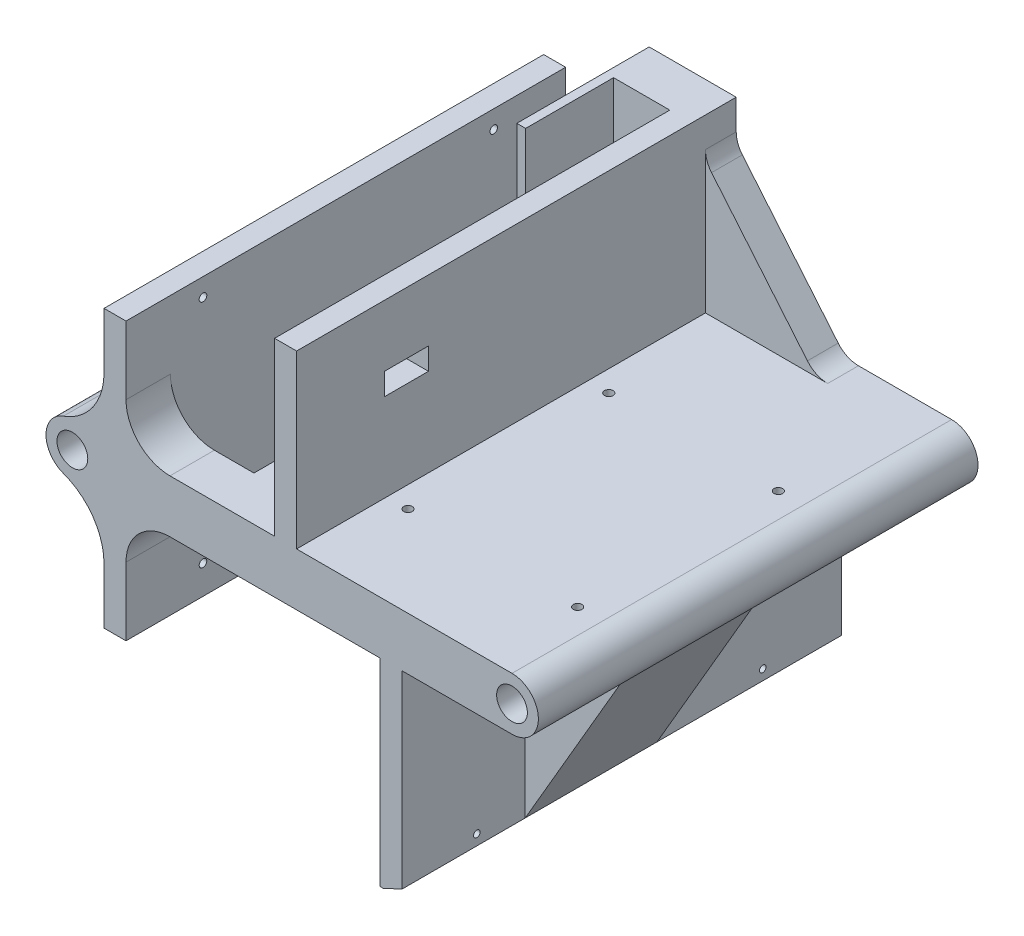
from build123d import *

# Parameters (mm, degrees)
SKETCH1_R            = 4.445
BOSS_EXTRUDE1_DEPTH  = 127
SKETCH7_W            = 6.35
SKETCH7_H            = 57.15
SKETCH7_H_2          = 80.01
SKETCH7_H_3          = 66.04
BOSS_EXTRUDE4_DEPTH  = 127
CUT_EXTRUDE2_REACH   = 191.917
SKETCH8_R            = 1.0999978
CUT_EXTRUDE4_REACH   = 200.726
SKETCH11_W           = 42.926
SKETCH11_H           = 101.345290086
FILLET1_R            = 17.78
CUT_EXTRUDE6_REACH   = 200.726
SKETCH14_R           = 1.249999967
SKETCH15_W           = 6.35
SKETCH15_H           = 127
CUT_EXTRUDE7_DEPTH   = 7.62
SKETCH16_W           = 12.827354957
SKETCH16_H           = 49.53
BOSS_EXTRUDE5_DEPTH  = 16.256
SKETCH17_W           = 38.227354957
SKETCH17_H           = 49.53
BOSS_EXTRUDE6_DEPTH  = 2.54
SKETCH18_W           = 21.632068301
SKETCH18_H           = 15.24
BOSS_EXTRUDE7_DEPTH  = 101.345290086
FILLET2_R            = 12.7
SKETCH23_R           = 0.95
CUT_EXTRUDE8_DEPTH   = 25.4
CHAMFER1_SIZE        = 2.54
CHAMFER1_SIZE2       = 5.447047578
BOSS_EXTRUDE10_DEPTH = 38.1
SKETCH26_W           = 73.406
SKETCH26_H           = 32.385
BOSS_EXTRUDE11_DEPTH = 12.827354957
FILLET3_R            = 12.7
BOSS_EXTRUDE12_DEPTH = 8.89
FILLET4_R            = 7.62
SKETCH28_W           = 6.35
SKETCH28_H           = 12.7
CUT_EXTRUDE9_DEPTH   = 25.4
SKETCH29_W           = 12.7
SKETCH29_H           = 6.35
CUT_EXTRUDE10_DEPTH  = 25.4


with BuildPart() as part:
    # Sketch1 → Boss-Extrude1 (new body)
    with BuildSketch(Plane.XY):
        with BuildLine():
            Line((0, -7.62), (127, -7.62))
            ThreePointArc((127, -7.62), (134.62, 0), (127, 7.62))
            Line((127, 7.62), (0, 7.62))
            ThreePointArc((0, 7.62), (-7.62, 0), (0, -7.62))
        make_face()
        with Locations((127, 0)):
            Circle(SKETCH1_R, mode=Mode.SUBTRACT)
        Circle(SKETCH1_R, mode=Mode.SUBTRACT)
    extrude(amount=BOSS_EXTRUDE1_DEPTH)

    # Sketch7 → Boss-Extrude4 (add)
    with BuildSketch(Plane.XY.offset(127)):
        with Locations((92.075, -36.195)):
            Rectangle(SKETCH7_W, SKETCH7_H)
        with Locations((12.319, 0)):
            Rectangle(SKETCH7_W, SKETCH7_H_2)
        with Locations((61.595, 31.75)):
            Rectangle(SKETCH7_W, SKETCH7_H_3)
    extrude(amount=-BOSS_EXTRUDE4_DEPTH)

    # Sketch8 → Cut-Extrude2 (cut, up to next)
    with BuildSketch(Plane.ZY.offset(-9.144), mode=Mode.PRIVATE) as cut_extrude2_sk1:
        with Locations(Location((104.763196308, 34.801440473, 0), (0, 0, 270))):
            Circle(SKETCH8_R)
    cut_extrude2_tool1 = extrude(cut_extrude2_sk1.sketch, amount=-CUT_EXTRUDE2_REACH, mode=Mode.PRIVATE) & part.part
    # Sketch8 → Cut-Extrude2 (cut, up to next)
    with BuildSketch(Plane.ZY.offset(-9.144), mode=Mode.PRIVATE) as cut_extrude2_sk2:
        with Locations(Location((104.763196308, -31.698559623, 0), (0, 0, 270))):
            Circle(SKETCH8_R)
    cut_extrude2_tool2 = extrude(cut_extrude2_sk2.sketch, amount=-CUT_EXTRUDE2_REACH, mode=Mode.PRIVATE) & part.part
    # Sketch8 → Cut-Extrude2 (cut, up to next)
    with BuildSketch(Plane.ZY.offset(-9.144), mode=Mode.PRIVATE) as cut_extrude2_sk3:
        with Locations(Location((20.763196414, -31.698559623, 0), (0, 0, 270))):
            Circle(SKETCH8_R)
    cut_extrude2_tool3 = extrude(cut_extrude2_sk3.sketch, amount=-CUT_EXTRUDE2_REACH, mode=Mode.PRIVATE) & part.part
    # Sketch8 → Cut-Extrude2 (cut, up to next)
    with BuildSketch(Plane.ZY.offset(-9.144), mode=Mode.PRIVATE) as cut_extrude2_sk4:
        with Locations(Location((20.763196414, 34.801440473, 0), (0, 0, 270))):
            Circle(SKETCH8_R)
    cut_extrude2_tool4 = extrude(cut_extrude2_sk4.sketch, amount=-CUT_EXTRUDE2_REACH, mode=Mode.PRIVATE) & part.part
    add(cut_extrude2_tool1.solids().sort_by_distance((9.144, 34.80144, 104.763196))[0], mode=Mode.SUBTRACT)
    add(cut_extrude2_tool2.solids().sort_by_distance((9.144, -31.69856, 104.763196))[0], mode=Mode.SUBTRACT)
    add(cut_extrude2_tool3.solids().sort_by_distance((9.144, -31.69856, 20.763196))[0], mode=Mode.SUBTRACT)
    add(cut_extrude2_tool4.solids().sort_by_distance((9.144, 34.80144, 20.763196))[0], mode=Mode.SUBTRACT)

    # Sketch11 → Cut-Extrude4 (cut, up to next)
    with BuildSketch(Plane.XZ.offset(7.62), mode=Mode.PRIVATE) as cut_extrude4_sk1:
        with Locations((36.957, 63.5)):
            Rectangle(SKETCH11_W, SKETCH11_H)
    cut_extrude4_tool1 = extrude(cut_extrude4_sk1.sketch, amount=-CUT_EXTRUDE4_REACH, mode=Mode.PRIVATE) & part.part
    add(cut_extrude4_tool1.solids().sort_by_distance((36.957, -7.62, 63.5))[0], mode=Mode.SUBTRACT)

    # Fillet1
    fillet1_edges = [part.edges().sort_by_distance(p)[0] for p in [
        (9.144, -7.62, 63.5),
        (9.144, 7.62, 63.5),
    ]]
    fillet(fillet1_edges, radius=FILLET1_R)

    # Sketch14 → Cut-Extrude6 (cut, up to next)
    with BuildSketch(Plane(origin=(0, 7.62, 0), x_dir=(1, 0, 0), z_dir=(0, 1, 0)), mode=Mode.PRIVATE) as cut_extrude6_sk1:
        with Locations(Location((119.866000044, -42.90656366, 0), (0, 0, 270))):
            Circle(SKETCH14_R)
    cut_extrude6_tool1 = extrude(cut_extrude6_sk1.sketch, amount=-CUT_EXTRUDE6_REACH, mode=Mode.PRIVATE) & part.part
    # Sketch14 → Cut-Extrude6 (cut, up to next)
    with BuildSketch(Plane(origin=(0, 7.62, 0), x_dir=(1, 0, 0), z_dir=(0, 1, 0)), mode=Mode.PRIVATE) as cut_extrude6_sk2:
        with Locations(Location((70.866, -42.90656366, 0), (0, 0, 270))):
            Circle(SKETCH14_R)
    cut_extrude6_tool2 = extrude(cut_extrude6_sk2.sketch, amount=-CUT_EXTRUDE6_REACH, mode=Mode.PRIVATE) & part.part
    # Sketch14 → Cut-Extrude6 (cut, up to next)
    with BuildSketch(Plane(origin=(0, 7.62, 0), x_dir=(1, 0, 0), z_dir=(0, 1, 0)), mode=Mode.PRIVATE) as cut_extrude6_sk3:
        with Locations(Location((70.866, -100.906563738, 0), (0, 0, 270))):
            Circle(SKETCH14_R)
    cut_extrude6_tool3 = extrude(cut_extrude6_sk3.sketch, amount=-CUT_EXTRUDE6_REACH, mode=Mode.PRIVATE) & part.part
    # Sketch14 → Cut-Extrude6 (cut, up to next)
    with BuildSketch(Plane(origin=(0, 7.62, 0), x_dir=(1, 0, 0), z_dir=(0, 1, 0)), mode=Mode.PRIVATE) as cut_extrude6_sk4:
        with Locations(Location((119.866000044, -100.906563738, 0), (0, 0, 270))):
            Circle(SKETCH14_R)
    cut_extrude6_tool4 = extrude(cut_extrude6_sk4.sketch, amount=-CUT_EXTRUDE6_REACH, mode=Mode.PRIVATE) & part.part
    add(cut_extrude6_tool1.solids().sort_by_distance((119.866, 7.62, 42.906564))[0], mode=Mode.SUBTRACT)
    add(cut_extrude6_tool2.solids().sort_by_distance((70.866, 7.62, 42.906564))[0], mode=Mode.SUBTRACT)
    add(cut_extrude6_tool3.solids().sort_by_distance((70.866, 7.62, 100.906564))[0], mode=Mode.SUBTRACT)
    add(cut_extrude6_tool4.solids().sort_by_distance((119.866, 7.62, 100.906564))[0], mode=Mode.SUBTRACT)

    # Sketch15 → Cut-Extrude7 (cut)
    with BuildSketch(Plane(origin=(0, 64.77, 0), x_dir=(1, 0, 0), z_dir=(0, 1, 0))):
        with Locations((61.595, -63.5)):
            Rectangle(SKETCH15_W, SKETCH15_H)
    extrude(amount=-CUT_EXTRUDE7_DEPTH, mode=Mode.SUBTRACT)

    # Sketch16 → Boss-Extrude5 (add)
    with BuildSketch(Plane.ZY.offset(-58.42)):
        with Locations((6.413677479, 32.385)):
            Rectangle(SKETCH16_W, SKETCH16_H)
    extrude(amount=BOSS_EXTRUDE5_DEPTH)

    # Sketch17 → Boss-Extrude6 (add)
    with BuildSketch(Plane.ZY.offset(-42.164)):
        with Locations((19.113677479, 32.385)):
            Rectangle(SKETCH17_W, SKETCH17_H)
    extrude(amount=BOSS_EXTRUDE6_DEPTH)

    # Sketch18 → Boss-Extrude7 (add)
    with BuildSketch(Plane.XY.offset(12.827354957)):
        with Locations((50.440034151, 0)):
            Rectangle(SKETCH18_W, SKETCH18_H)
    extrude(amount=BOSS_EXTRUDE7_DEPTH)

    # Fillet2
    fillet2_edges = [part.edges().sort_by_distance(p)[0] for p in [
        (15.494, 7.62, 6.413677479),
        (15.494, -7.62, 120.586322521),
        (15.494, 7.62, 120.586322521),
    ]]
    fillet(fillet2_edges, radius=FILLET2_R)

    # Sketch23 → Cut-Extrude8 (cut)
    with BuildSketch(Plane(origin=(95.25, 0, 0), x_dir=(0, 0, -1), z_dir=(1, 0, 0))):
        with Locations(Location((-105.41, -10.922, 0), (0, 0, 90))):
            Circle(SKETCH23_R)
        with Locations(Location((-22.81, -10.922, 0), (0, 0, 270))):
            Circle(SKETCH23_R)
        with Locations(Location((-22.81, -59.222, 0), (0, 0, 90))):
            Circle(SKETCH23_R)
        with Locations(Location((-105.41, -59.222, 0), (0, 0, 270))):
            Circle(SKETCH23_R)
    extrude(amount=-CUT_EXTRUDE8_DEPTH, mode=Mode.SUBTRACT)

    # Chamfer1
    chamfer1_edges = [part.edges().sort_by_distance(p)[0] for p in [
        (95.25, -64.77, 63.5),
    ]]
    chamfer1_side = [part.faces().sort_by_distance(p)[0] for p in [
        (95.25, -36.196757503, 63.499045346),
    ]]
    chamfer(chamfer1_edges, length=CHAMFER1_SIZE, length2=CHAMFER1_SIZE2, reference=chamfer1_side[0])

    # Sketch25 → Boss-Extrude10 (add)
    with BuildSketch(Plane.XY.offset(91.44)):
        Polygon((127, -7.62), (95.25, -7.62), (95.25, -62.23), align=None)
    extrude(amount=-BOSS_EXTRUDE10_DEPTH)

    # Sketch26 → Boss-Extrude11 (add)
    with BuildSketch(Plane(origin=(0, 0, 0), x_dir=(-1, 0, 0), z_dir=(0, 0, -1))):
        with Locations((-52.197, -23.8125)):
            Rectangle(SKETCH26_W, SKETCH26_H)
    extrude(amount=-BOSS_EXTRUDE11_DEPTH)

    # Fillet3
    fillet3_edges = [part.edges().sort_by_distance(p)[0] for p in [
        (88.9, -40.005, 6.413677479),
    ]]
    fillet(fillet3_edges, radius=FILLET3_R)

    # Sketch27 → Boss-Extrude12 (add)
    with BuildSketch(Plane(origin=(0, 0, 0), x_dir=(-1, 0, 0), z_dir=(0, 0, -1))):
        Polygon((-64.77, 7.62), (-64.77, 45.72), (-96.52, 7.62), align=None)
    extrude(amount=-BOSS_EXTRUDE12_DEPTH)

    # Fillet4
    fillet4_edges = [part.edges().sort_by_distance(p)[0] for p in [
        (96.52, 7.62, 4.445),
        (64.77, 45.72, 4.445),
    ]]
    fillet(fillet4_edges, radius=FILLET4_R)

    # Sketch28 → Cut-Extrude9 (cut)
    with BuildSketch(Plane.XZ.offset(7.62)):
        with Locations((52.681214832, 95.25)):
            Rectangle(SKETCH28_W, SKETCH28_H)
    extrude(amount=-CUT_EXTRUDE9_DEPTH, mode=Mode.SUBTRACT)

    # Sketch29 → Cut-Extrude10 (cut)
    with BuildSketch(Plane(origin=(64.77, 0, 0), x_dir=(0, 0, -1), z_dir=(1, 0, 0))):
        with Locations((-95.25, 36.195)):
            Rectangle(SKETCH29_W, SKETCH29_H)
    extrude(amount=-CUT_EXTRUDE10_DEPTH, mode=Mode.SUBTRACT)


solid = part.part
